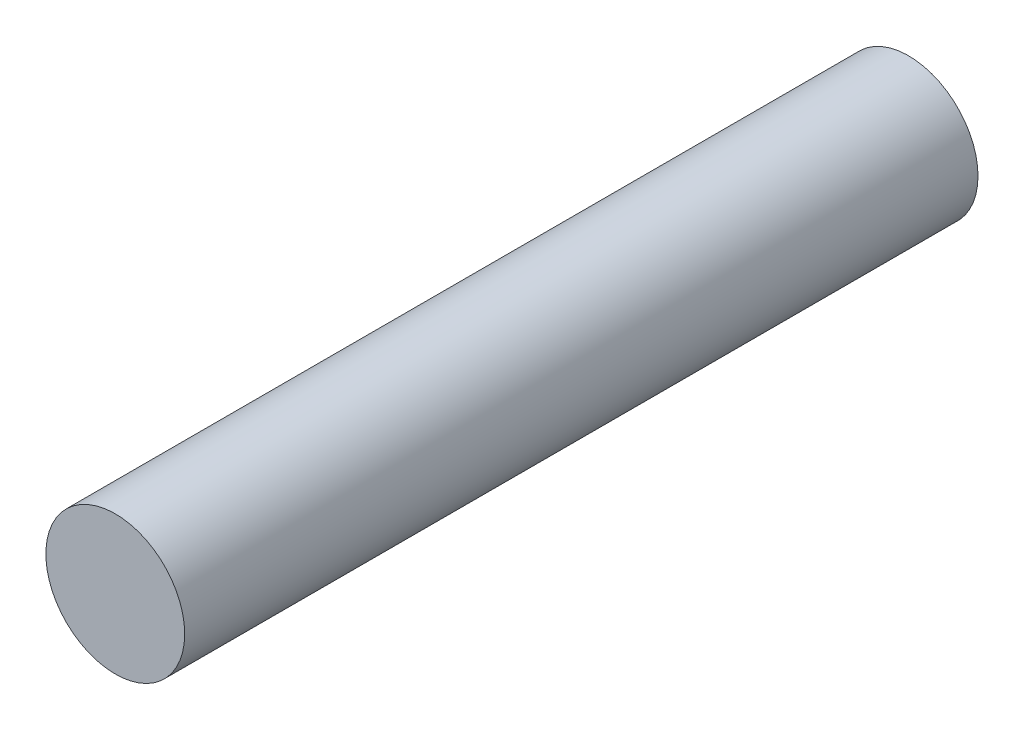
from build123d import *

# Parameters (mm, degrees)
SKETCH_1_R      = 1.75
EXTRUDE_1_DEPTH = 20


with BuildPart() as part:
    # 草图1 → 凸台-拉伸1 (new body)
    with BuildSketch(Plane.XY):
        Circle(SKETCH_1_R)
    extrude(amount=EXTRUDE_1_DEPTH)


solid = part.part
